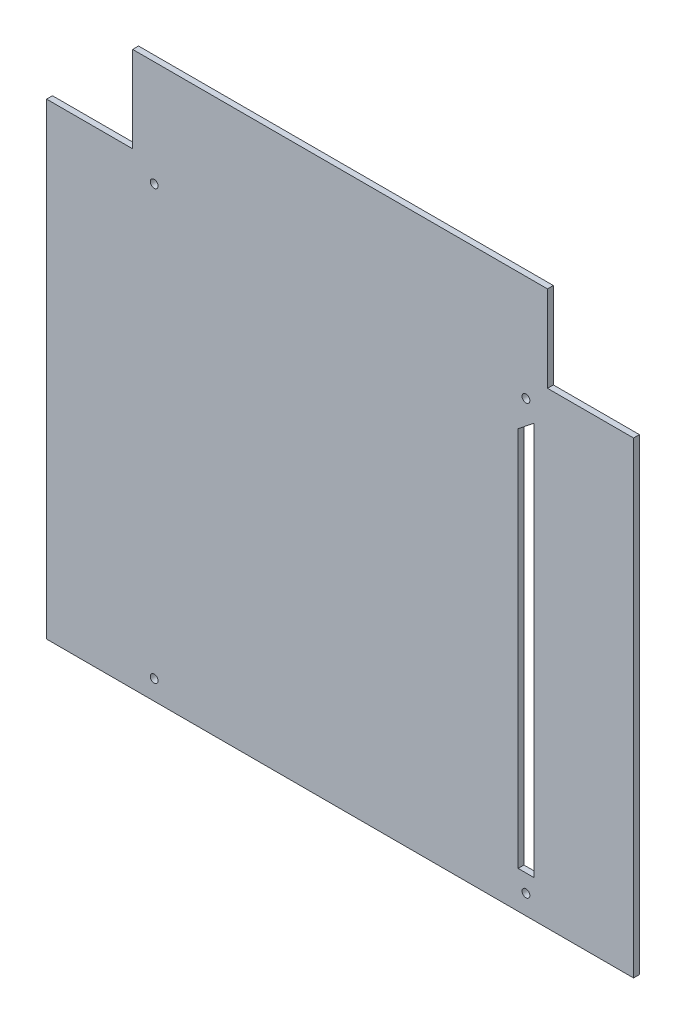
from build123d import *

# Parameters (mm, degrees)
SKETCH1_R           = 2
BOSS_EXTRUDE1_DEPTH = 3


with BuildPart() as part:
    # Sketch1 → Boss-Extrude1 (new body)
    with BuildSketch(Plane.XY):
        Polygon((-150, -119.5), (150, -119.5), (150, 119.5), (106, 119.5), (106, 163.5), (-106, 163.5), (-106, 119.5), (-150, 119.5), align=None)
        with Locations((-95, -109.5)):
            Circle(SKETCH1_R, mode=Mode.SUBTRACT)
        with Locations((95, -109.5)):
            Circle(SKETCH1_R, mode=Mode.SUBTRACT)
        Polygon((91, 94.126666667), (99, 100.5), (99, -100.5), (91, -100.5), align=None, mode=Mode.SUBTRACT)
        with Locations((-95, 109.5)):
            Circle(SKETCH1_R, mode=Mode.SUBTRACT)
        with Locations((95, 109.5)):
            Circle(SKETCH1_R, mode=Mode.SUBTRACT)
    extrude(amount=BOSS_EXTRUDE1_DEPTH)


solid = part.part
